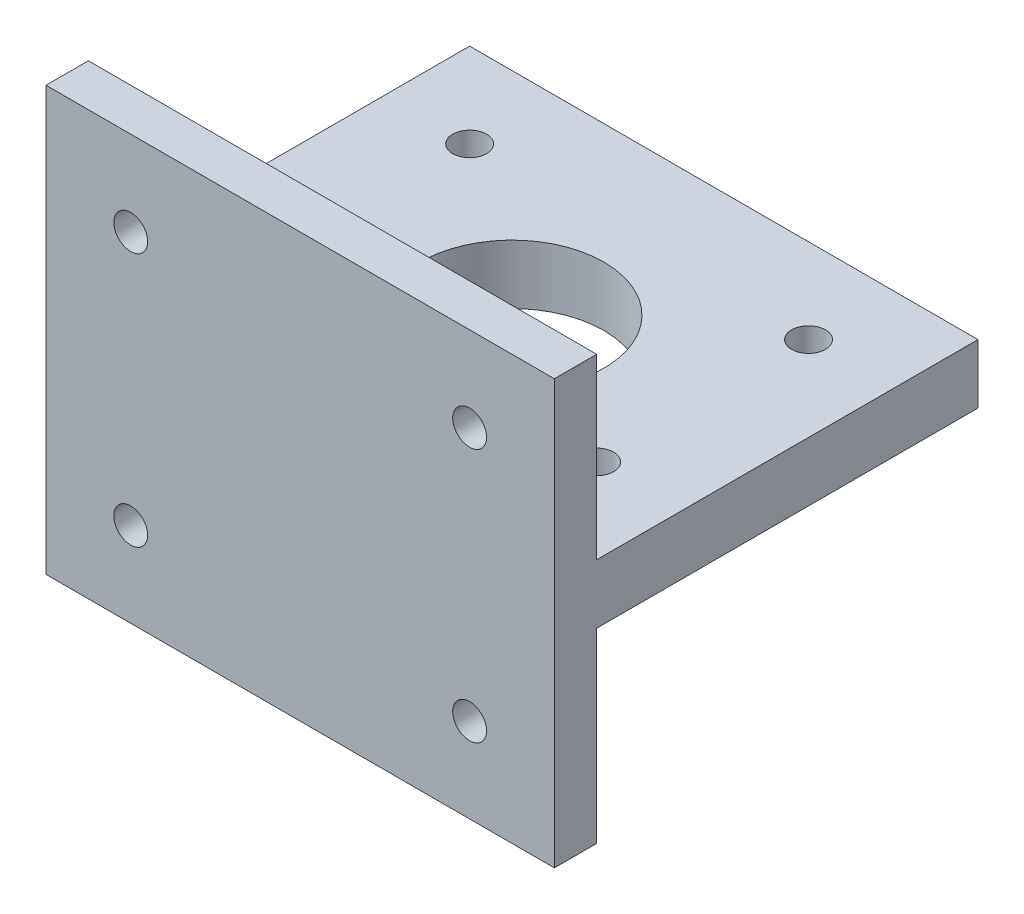
from build123d import *

# Parameters (mm, degrees)
SKETCH_2_W          = 60
SKETCH_2_H          = 50
SKETCH_2_R          = 10.85
EXTRUDE_1_DEPTH     = 7
SKETCH_4_W          = 60
SKETCH_4_H          = 5
EXTRUDE_2_DEPTH     = 25
SKETCH_6_R          = 2
CUT_EXTRUDE_1_DEPTH = 50
SKETCH_8_R          = 2
CUT_EXTRUDE_4_DEPTH = 50


with BuildPart() as part:
    # 草图2 → 凸台-拉伸1 (new body)
    with BuildSketch(Plane(origin=(0, 0, 0), x_dir=(1, 0, 0), z_dir=(0, 1, 0))):
        Rectangle(SKETCH_2_W, SKETCH_2_H)
        with Locations(Location((0, 0, 0), (0, 0, 270))):
            Circle(SKETCH_2_R, mode=Mode.SUBTRACT)
    extrude(amount=EXTRUDE_1_DEPTH)

    # 草图4 → 凸台-拉伸2 (add, symmetric)
    with BuildSketch(Plane(origin=(0, 3, 0), x_dir=(1, 0, 0), z_dir=(0, 1, 0))):
        with Locations((0, -22.5)):
            Rectangle(SKETCH_4_W, SKETCH_4_H)
    extrude(amount=EXTRUDE_2_DEPTH, both=True)

    # 草图6 → 切除-拉伸1 (cut)
    with BuildSketch(Plane.XY.offset(25)):
        with BuildLine():
            ThreePointArc((-18, 18), (-18.585786438, 19.414213562), (-20, 20))
            Line((-20, 20), (-20, 18))
            Line((-20, 18), (-22, 18))
            ThreePointArc((-22, 18), (-20, 16), (-18, 18))
        make_face()
        with BuildLine():
            Line((-20, 18), (-20, 20))
            ThreePointArc((-20, 20), (-21.414213562, 19.414213562), (-22, 18))
            Line((-22, 18), (-20, 18))
        make_face()
        with Locations((20, 18)):
            Circle(SKETCH_6_R)
        with Locations((-20, -12)):
            Circle(SKETCH_6_R)
        with Locations((20, -12)):
            Circle(SKETCH_6_R)
    extrude(amount=-CUT_EXTRUDE_1_DEPTH, mode=Mode.SUBTRACT)

    # 草图8 → 切除-拉伸4 (cut)
    with BuildSketch(Plane.XZ):
        with BuildLine():
            ThreePointArc((-18, 10), (-18.585786438, 11.414213562), (-20, 12))
            Line((-20, 12), (-20, 10))
            Line((-20, 10), (-22, 10))
            ThreePointArc((-22, 10), (-20, 8), (-18, 10))
        make_face()
        with BuildLine():
            Line((-20, 10), (-20, 12))
            ThreePointArc((-20, 12), (-21.414213562, 11.414213562), (-22, 10))
            Line((-22, 10), (-20, 10))
        make_face()
        with Locations(Location((20, 10, 0), (0, 0, 270))):
            Circle(SKETCH_8_R)
        with Locations(Location((20, -15, 0), (0, 0, 270))):
            Circle(SKETCH_8_R)
        with Locations(Location((-20, -15, 0), (0, 0, 270))):
            Circle(SKETCH_8_R)
    extrude(amount=-CUT_EXTRUDE_4_DEPTH, mode=Mode.SUBTRACT)


solid = part.part
